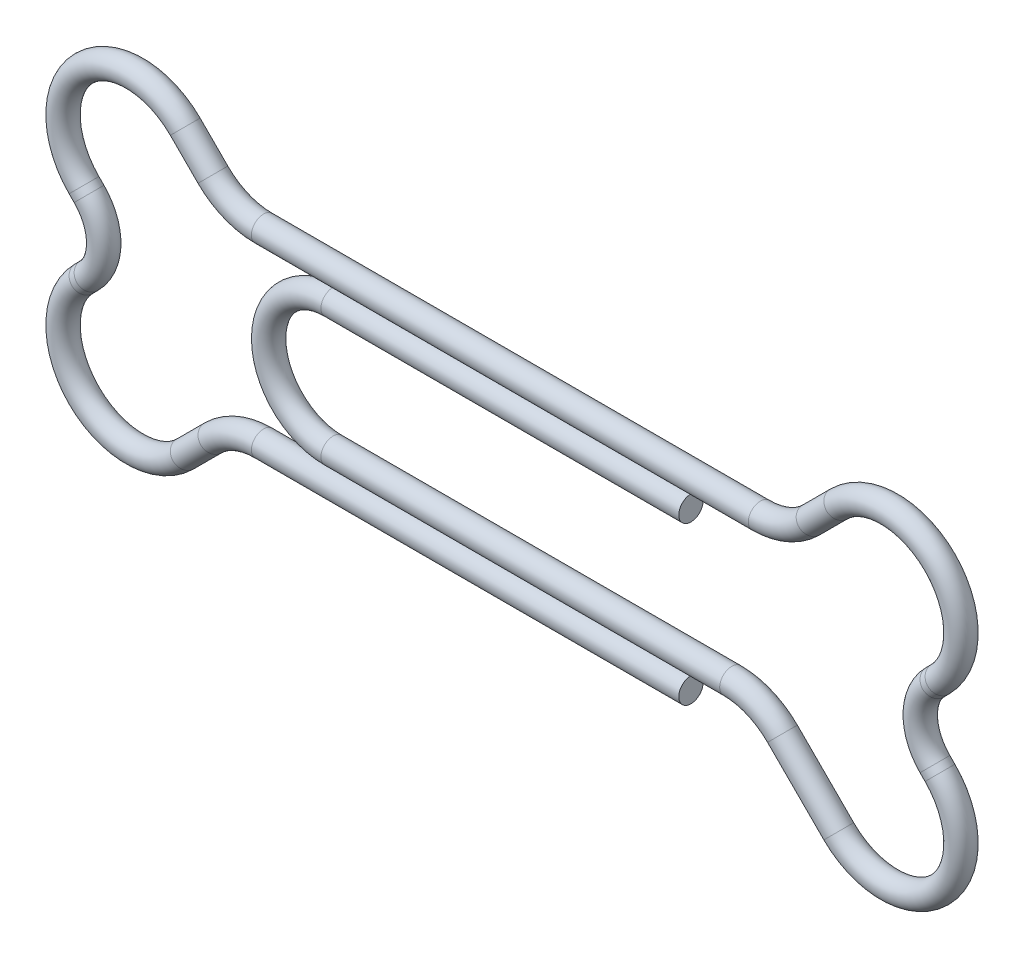
from build123d import *

# Parameters (mm, degrees)
SKETCH_3_R = 0.85


with BuildPart() as part:
    # По траектории1: sweep along a path in Эскиз2
    with BuildLine(Plane.XY) as sweep_1_path:
        Line((25, 4.5), (0, 4.5))
        ThreePointArc((0, 4.5), (-4.5, 0), (0, -4.5))
        Line((0, -4.5), (25, -4.5))
        Line((25, -4.5), (27.857864376, -4.5))
        ThreePointArc((27.857864376, -4.5), (29.771281538, -4.880602337), (31.393398282, -5.964466094))
        Line((31.393398282, -5.964466094), (35.328427125, -9.899494937))
        ThreePointArc((35.328427125, -9.899494937), (42.399494937, -9.899494937), (42.399494937, -2.828427125))
        Line((42.399494937, -2.828427125), (42.045941546, -2.474873734))
        ThreePointArc((42.045941546, -2.474873734), (41.02081528, 0), (42.045941546, 2.474873734))
        Line((42.045941546, 2.474873734), (42.399494937, 2.828427125))
        ThreePointArc((42.399494937, 2.828427125), (42.399494937, 9.899494937), (35.328427125, 9.899494937))
        Line((35.328427125, 9.899494937), (33.393398282, 7.964466094))
        ThreePointArc((33.393398282, 7.964466094), (31.771281538, 6.880602337), (29.857864376, 6.5))
        Line((29.857864376, 6.5), (-4.857864376, 6.5))
        ThreePointArc((-4.857864376, 6.5), (-6.771281538, 6.880602337), (-8.393398282, 7.964466094))
        Line((-8.393398282, 7.964466094), (-10.328427125, 9.899494937))
        ThreePointArc((-10.328427125, 9.899494937), (-17.399494937, 9.899494937), (-17.399494937, 2.828427125))
        Line((-17.399494937, 2.828427125), (-17.045941546, 2.474873734))
        ThreePointArc((-17.045941546, 2.474873734), (-16.02081528, 0), (-17.045941546, -2.474873734))
        Line((-17.045941546, -2.474873734), (-17.399494937, -2.828427125))
        ThreePointArc((-17.399494937, -2.828427125), (-17.399494937, -9.899494937), (-10.328427125, -9.899494937))
        Line((-10.328427125, -9.899494937), (-8.393398282, -7.964466094))
        ThreePointArc((-8.393398282, -7.964466094), (-6.771281538, -6.880602337), (-4.857864376, -6.5))
        Line((-4.857864376, -6.5), (25, -6.5))
    # Эскиз3 → По траектории1 (sweep)
    with BuildSketch(Plane(origin=(25, -6.5, 0), x_dir=(0, 0, -1), z_dir=(1, 0, 0))):
        Circle(SKETCH_3_R)
    sweep(path=sweep_1_path.line)


solid = part.part
